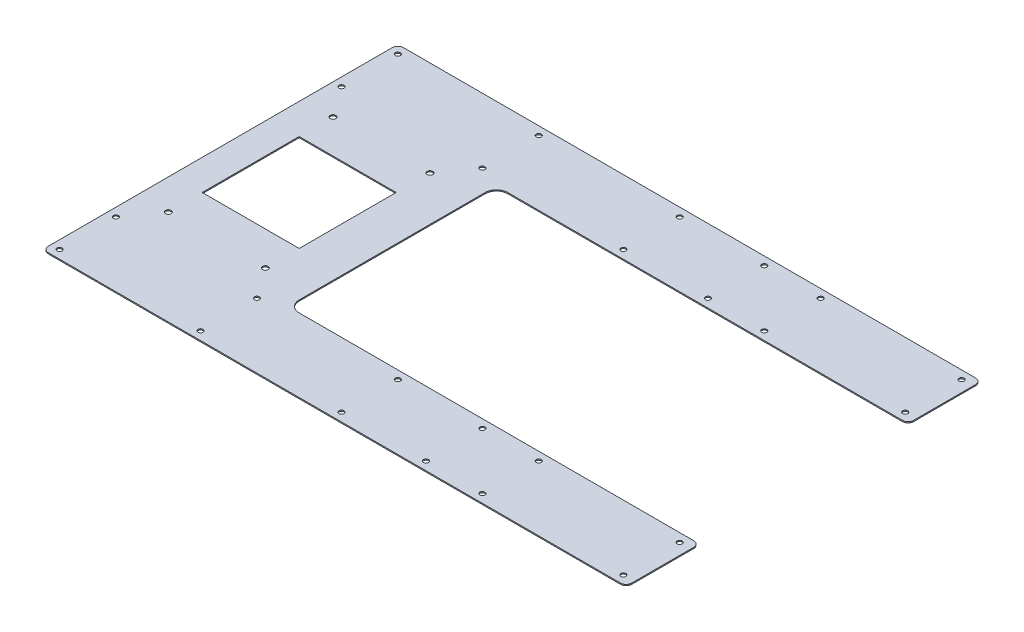
from build123d import *

# Parameters (mm, degrees)
SKETCH1_R           = 2.25
SKETCH1_R_2         = 2.5
SKETCH1_W           = 86
SKETCH1_H           = 86
BOSS_EXTRUDE1_DEPTH = 1
FILLET1_R           = 5
FILLET2_R           = 10


with BuildPart() as part:
    # Sketch1 → Boss-Extrude1 (new body)
    with BuildSketch(Plane(origin=(0, 0, 0), x_dir=(1, 0, 0), z_dir=(0, 1, 0))):
        Polygon((-70, -157.5), (447.5, -157.5), (447.5, -92.5), (82.5, -92.5), (82.5, 92.5), (447.5, 92.5), (447.5, 157.5), (-70, 157.5), align=None)
        with Locations(Location((-62.5, 100, 0), (0, 0, 270))):
            Circle(SKETCH1_R, mode=Mode.SUBTRACT)
        with Locations(Location((-62.5, -100, 0), (0, 0, 270))):
            Circle(SKETCH1_R, mode=Mode.SUBTRACT)
        with Locations(Location((-62.5, 150, 0), (0, 0, 270))):
            Circle(SKETCH1_R, mode=Mode.SUBTRACT)
        with Locations(Location((-62.5, -150, 0), (0, 0, 270))):
            Circle(SKETCH1_R, mode=Mode.SUBTRACT)
        with Locations(Location((62.5, -100, 0), (0, 0, 270))):
            Circle(SKETCH1_R, mode=Mode.SUBTRACT)
        with Locations(Location((62.5, -150, 0), (0, 0, 270))):
            Circle(SKETCH1_R, mode=Mode.SUBTRACT)
        with Locations(Location((62.5, 100, 0), (0, 0, 270))):
            Circle(SKETCH1_R, mode=Mode.SUBTRACT)
        with Locations(Location((62.5, 150, 0), (0, 0, 270))):
            Circle(SKETCH1_R, mode=Mode.SUBTRACT)
        with Locations(Location((187.5, -100, 0), (0, 0, 270))):
            Circle(SKETCH1_R, mode=Mode.SUBTRACT)
        with Locations(Location((187.5, -150, 0), (0, 0, 270))):
            Circle(SKETCH1_R, mode=Mode.SUBTRACT)
        with Locations(Location((187.5, 100, 0), (0, 0, 270))):
            Circle(SKETCH1_R, mode=Mode.SUBTRACT)
        with Locations(Location((187.5, 150, 0), (0, 0, 270))):
            Circle(SKETCH1_R, mode=Mode.SUBTRACT)
        with Locations(Location((312.5, -100, 0), (0, 0, 270))):
            Circle(SKETCH1_R, mode=Mode.SUBTRACT)
        with Locations(Location((312.5, -150, 0), (0, 0, 270))):
            Circle(SKETCH1_R, mode=Mode.SUBTRACT)
        with Locations(Location((312.5, 100, 0), (0, 0, 270))):
            Circle(SKETCH1_R, mode=Mode.SUBTRACT)
        with Locations(Location((312.5, 150, 0), (0, 0, 270))):
            Circle(SKETCH1_R, mode=Mode.SUBTRACT)
        with Locations(Location((437.5, -100, 0), (0, 0, 270))):
            Circle(SKETCH1_R, mode=Mode.SUBTRACT)
        with Locations(Location((437.5, -150, 0), (0, 0, 270))):
            Circle(SKETCH1_R, mode=Mode.SUBTRACT)
        with Locations(Location((437.5, 100, 0), (0, 0, 270))):
            Circle(SKETCH1_R, mode=Mode.SUBTRACT)
        with Locations(Location((437.5, 150, 0), (0, 0, 270))):
            Circle(SKETCH1_R, mode=Mode.SUBTRACT)
        with Locations(Location((-43, -73, 0), (0, 0, 270))):
            Circle(SKETCH1_R_2, mode=Mode.SUBTRACT)
        with Locations(Location((43, -73, 0), (0, 0, 270))):
            Circle(SKETCH1_R_2, mode=Mode.SUBTRACT)
        with Locations(Location((-43, 73, 0), (0, 0, 270))):
            Circle(SKETCH1_R_2, mode=Mode.SUBTRACT)
        with Locations(Location((43, 73, 0), (0, 0, 270))):
            Circle(SKETCH1_R_2, mode=Mode.SUBTRACT)
        with Locations(Location((262.5, 150, 0), (0, 0, 270))):
            Circle(SKETCH1_R, mode=Mode.SUBTRACT)
        with Locations(Location((262.5, 100, 0), (0, 0, 270))):
            Circle(SKETCH1_R, mode=Mode.SUBTRACT)
        with Locations(Location((262.5, -100, 0), (0, 0, 270))):
            Circle(SKETCH1_R, mode=Mode.SUBTRACT)
        with Locations(Location((262.5, -150, 0), (0, 0, 270))):
            Circle(SKETCH1_R, mode=Mode.SUBTRACT)
        Rectangle(SKETCH1_W, SKETCH1_H, mode=Mode.SUBTRACT)
    extrude(amount=BOSS_EXTRUDE1_DEPTH)

    # Fillet1
    fillet1_edges = [part.edges().sort_by_distance(p)[0] for p in [
        (447.5, 0.5, 92.5),
        (447.5, 0.5, 157.5),
        (-70, 0.5, 157.5),
        (-70, 0.5, -157.5),
        (447.5, 0.5, -157.5),
        (447.5, 0.5, -92.5),
    ]]
    fillet(fillet1_edges, radius=FILLET1_R)

    # Fillet2
    fillet2_edges = [part.edges().sort_by_distance(p)[0] for p in [
        (82.5, 0.5, -92.5),
        (82.5, 0.5, 92.5),
    ]]
    fillet(fillet2_edges, radius=FILLET2_R)


solid = part.part
